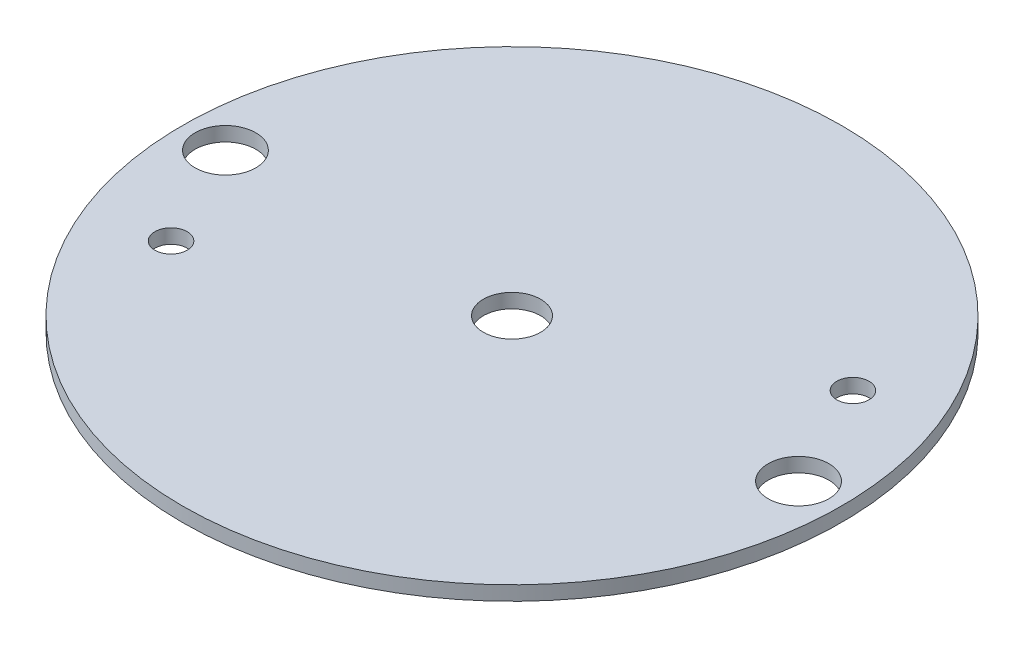
from build123d import *

# Parameters (mm, degrees)
SKETCH1_R           = 73.029292346
BOSS_EXTRUDE1_DEPTH = 3.175
SKETCH8_R           = 6.35
CUT_EXTRUDE3_DEPTH  = 16.256
SKETCH10_R          = 6.731
CUT_EXTRUDE4_DEPTH  = 25.4
SKETCH11_R          = 3.571875
CUT_EXTRUDE5_DEPTH  = 254


with BuildPart() as part:
    # Sketch1 → Boss-Extrude1 (new body)
    with BuildSketch(Plane(origin=(0, 0, 0), x_dir=(1, 0, 0), z_dir=(0, 1, 0))):
        with Locations(Location((0, 0, 0), (0, 0, 270))):
            Circle(SKETCH1_R)
    extrude(amount=BOSS_EXTRUDE1_DEPTH)

    # Sketch8 → Cut-Extrude3 (cut)
    with BuildSketch(Plane(origin=(0, 3.175, 0), x_dir=(1, 0, 0), z_dir=(0, 1, 0))):
        with Locations(Location((0, 0, 0), (0, 0, 270))):
            Circle(SKETCH8_R)
    extrude(amount=-CUT_EXTRUDE3_DEPTH, mode=Mode.SUBTRACT)

    # Sketch10 → Cut-Extrude4 (cut)
    with BuildSketch(Plane(origin=(0, 3.175, 0), x_dir=(1, 0, 0), z_dir=(0, 1, 0))):
        with Locations(Location((-63.5, 0, 0), (0, 0, 270))):
            Circle(SKETCH10_R)
        with Locations(Location((63.5, 0, 0), (0, 0, 270))):
            Circle(SKETCH10_R)
    extrude(amount=-CUT_EXTRUDE4_DEPTH, mode=Mode.SUBTRACT)

    # Sketch11 → Cut-Extrude5 (cut)
    with BuildSketch(Plane(origin=(0, 3.175, 0), x_dir=(1, 0, 0), z_dir=(0, 1, 0))):
        with Locations(Location((-52.128653384, -23.424901204, 0), (0, 0, 270))):
            Circle(SKETCH11_R)
        with Locations(Location((52.128653384, 23.424901204, 0), (0, 0, 270))):
            Circle(SKETCH11_R)
    extrude(amount=-CUT_EXTRUDE5_DEPTH, mode=Mode.SUBTRACT)


solid = part.part
